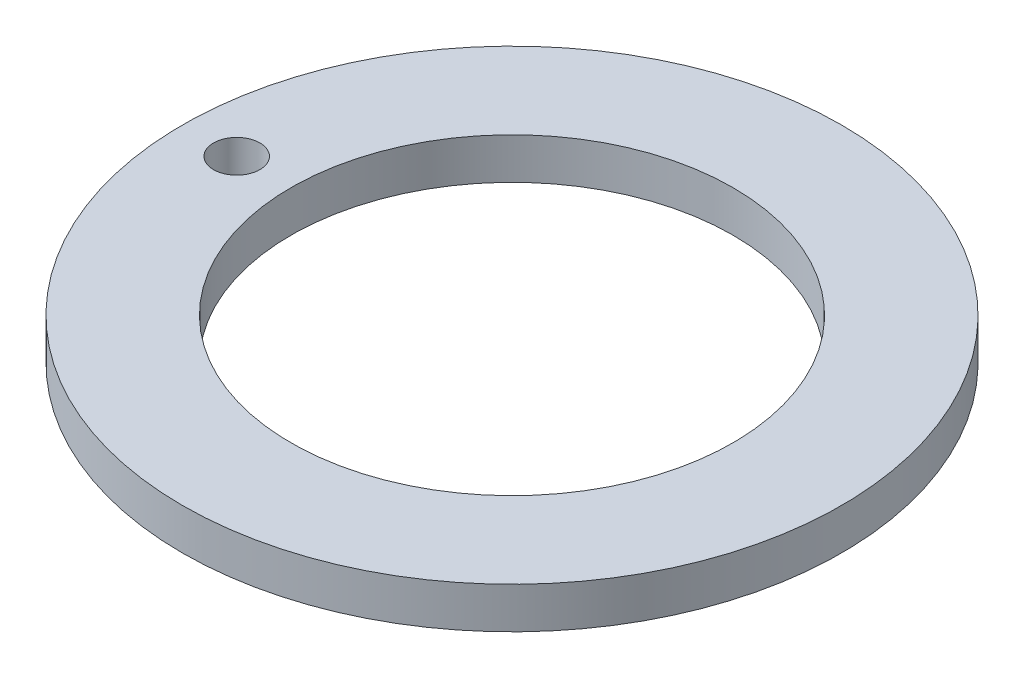
from build123d import *

# Parameters (mm, degrees)
SKETCH1_R           = 76.2
SKETCH1_R_2         = 51.1048
BOSS_EXTRUDE1_DEPTH = 9.525
SKETCH2_R           = 5.35813
CUT_EXTRUDE1_DEPTH  = 109.183203987


with BuildPart() as part:
    # Sketch1 → Boss-Extrude1 (new body)
    with BuildSketch(Plane(origin=(0, 0, 0), x_dir=(1, 0, 0), z_dir=(0, 1, 0))):
        with Locations(Location((0, 0, 0), (0, 0, 90))):
            Circle(SKETCH1_R)
        with Locations(Location((0, 0, 0), (0, 0, 90))):
            Circle(SKETCH1_R_2, mode=Mode.SUBTRACT)
    extrude(amount=BOSS_EXTRUDE1_DEPTH)

    # Sketch2 → Cut-Extrude1 (cut, through all)
    with BuildSketch(Plane(origin=(0, 9.525, 0), x_dir=(1, 0, 0), z_dir=(0, 1, 0))):
        with Locations(Location((-63.6524, 0, 0), (0, 0, 270))):
            Circle(SKETCH2_R)
    extrude(amount=-CUT_EXTRUDE1_DEPTH, mode=Mode.SUBTRACT)


solid = part.part
